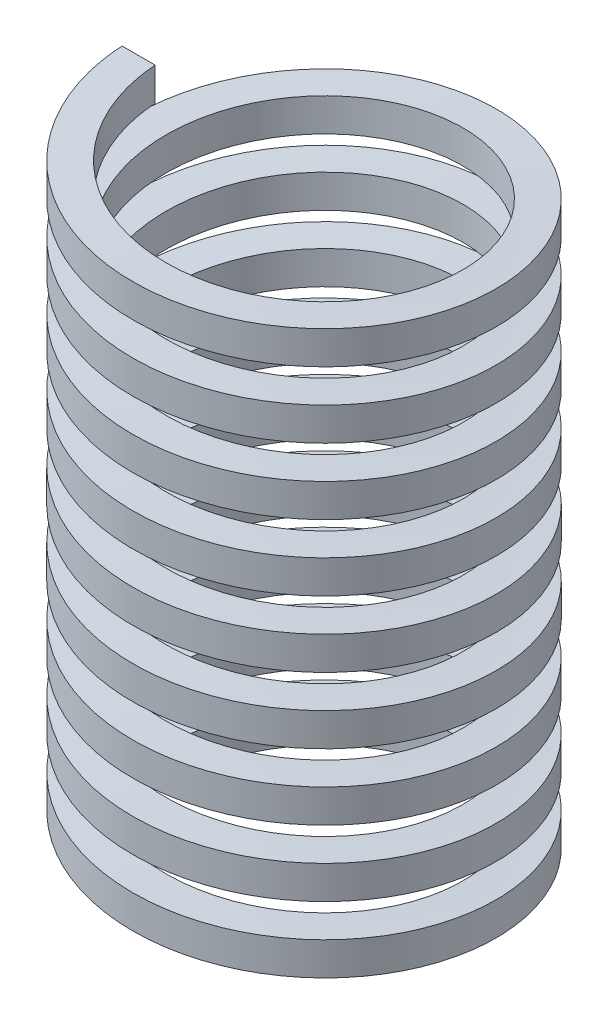
from build123d import *

# Parameters (mm, degrees)
SWEEP1_PITCH       = 20
SWEEP1_HEIGHT      = 180
SWEEP1_RADIUS      = 50
SWEEP1_START_ANGLE = -90
SKETCH2_W          = 10
SKETCH2_H          = 10


with BuildPart() as part:
    # Sweep1: sweep along a helix
    with BuildLine() as sweep1_path:
        add(Helix(SWEEP1_PITCH, SWEEP1_HEIGHT, SWEEP1_RADIUS, center=(0, 0, 0), direction=(0, 1, 0), lefthand=True, mode=Mode.PRIVATE).rotate(Axis((0, 0, 0), (0, 1, 0)), SWEEP1_START_ANGLE))
    # Sketch2 → Sweep1 (sweep)
    with BuildSketch(Plane.XY):
        with Locations((-50, 0)):
            Rectangle(SKETCH2_W, SKETCH2_H)
    sweep(path=sweep1_path.line, is_frenet=True)


solid = part.part
